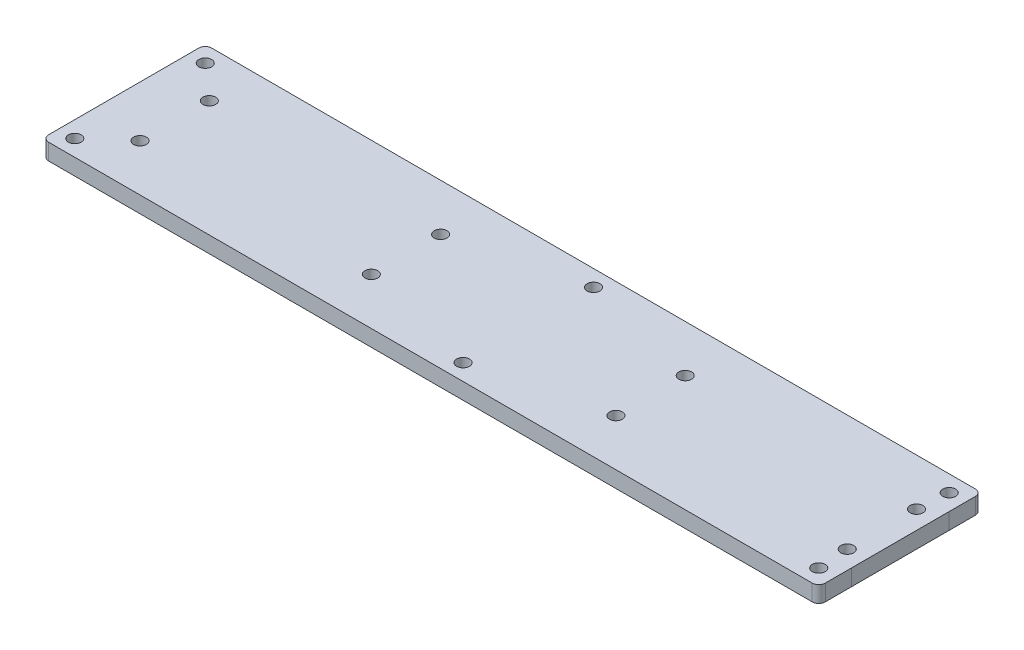
from build123d import *

# Parameters (mm, degrees)
SKETCH1_W           = 289.69
SKETCH1_H           = 12.7
SKETCH1_R           = 2.49
BOSS_EXTRUDE1_DEPTH = 6.35
FILLET1_R           = 2.54
SKETCH3_W           = 289.687
SKETCH3_H           = 38.1
SKETCH3_R           = 2.4892
BOSS_EXTRUDE2_DEPTH = 6.35


with BuildPart() as part:
    # Sketch1 → Boss-Extrude1 (new body)
    # profile 1 of 3: a face of its own
    with BuildSketch(Plane(origin=(0, 0, 0), x_dir=(1, 0, 0), z_dir=(0, 1, 0))):
        with Locations((0, -25.4)):
            Rectangle(SKETCH1_W, SKETCH1_H)
        with Locations(Location((138.495, -25.4, 0), (0, 0, 270))):
            Circle(SKETCH1_R, mode=Mode.SUBTRACT)
        with Locations(Location((0, -25.4, 0), (0, 0, 270))):
            Circle(SKETCH1_R, mode=Mode.SUBTRACT)
    # profile 2 of 3: a face of its own
    with BuildSketch(Plane(origin=(0, 0, 0), x_dir=(1, 0, 0), z_dir=(0, 1, 0))):
        Polygon((-144.845, 31.75), (-157.545, 31.75), (-157.545, -31.75), (-144.845, -31.75), (-144.845, -19.05), (-144.845, 19.05), align=None)
        with Locations(Location((-151.195, -25.4, 0), (0, 0, 270))):
            Circle(SKETCH1_R, mode=Mode.SUBTRACT)
        with Locations(Location((-151.195, 25.4, 0), (0, 0, 270))):
            Circle(SKETCH1_R, mode=Mode.SUBTRACT)
    # profile 3 of 3: a face of its own
    with BuildSketch(Plane(origin=(0, 0, 0), x_dir=(1, 0, 0), z_dir=(0, 1, 0))):
        with Locations((0, 25.4)):
            Rectangle(SKETCH1_W, SKETCH1_H)
        with Locations(Location((138.495, 25.4, 0), (0, 0, 270))):
            Circle(SKETCH1_R, mode=Mode.SUBTRACT)
        with Locations(Location((0, 25.4, 0), (0, 0, 270))):
            Circle(SKETCH1_R, mode=Mode.SUBTRACT)
    extrude(amount=BOSS_EXTRUDE1_DEPTH)

    # Fillet1
    fillet1_edges = [part.edges().sort_by_distance(p)[0] for p in [
        (144.845, 3.175, 31.75),
        (-157.545, 3.175, 31.75),
        (-157.545, 3.175, -31.75),
        (144.845, 3.175, -31.75),
    ]]
    fillet(fillet1_edges, radius=FILLET1_R)

    # Sketch3 → Boss-Extrude2 (add)
    with BuildSketch(Plane(origin=(0, 6.35, 0), x_dir=(1, 0, 0), z_dir=(0, 1, 0))):
        with Locations((-0.0015, 0)):
            Rectangle(SKETCH3_W, SKETCH3_H)
        with Locations(Location((-137.7076, 13.4874, 0), (0, 0, 270))):
            Circle(SKETCH3_R, mode=Mode.SUBTRACT)
        with Locations(Location((-137.733, -13.4874, 0), (0, 0, 270))):
            Circle(SKETCH3_R, mode=Mode.SUBTRACT)
        with Locations(Location((-47.6392, -13.4874, 0), (0, 0, 270))):
            Circle(SKETCH3_R, mode=Mode.SUBTRACT)
        with Locations(Location((-47.6392, 13.4874, 0), (0, 0, 270))):
            Circle(SKETCH3_R, mode=Mode.SUBTRACT)
        with Locations(Location((47.6108, 13.4874, 0), (0, 0, 270))):
            Circle(SKETCH3_R, mode=Mode.SUBTRACT)
        with Locations(Location((47.6108, -13.4874, 0), (0, 0, 270))):
            Circle(SKETCH3_R, mode=Mode.SUBTRACT)
        with Locations(Location((137.6792, 13.4874, 0), (0, 0, 270))):
            Circle(SKETCH3_R, mode=Mode.SUBTRACT)
        with Locations(Location((137.6792, -13.4874, 0), (0, 0, 270))):
            Circle(SKETCH3_R, mode=Mode.SUBTRACT)
    extrude(amount=-BOSS_EXTRUDE2_DEPTH)


solid = part.part
